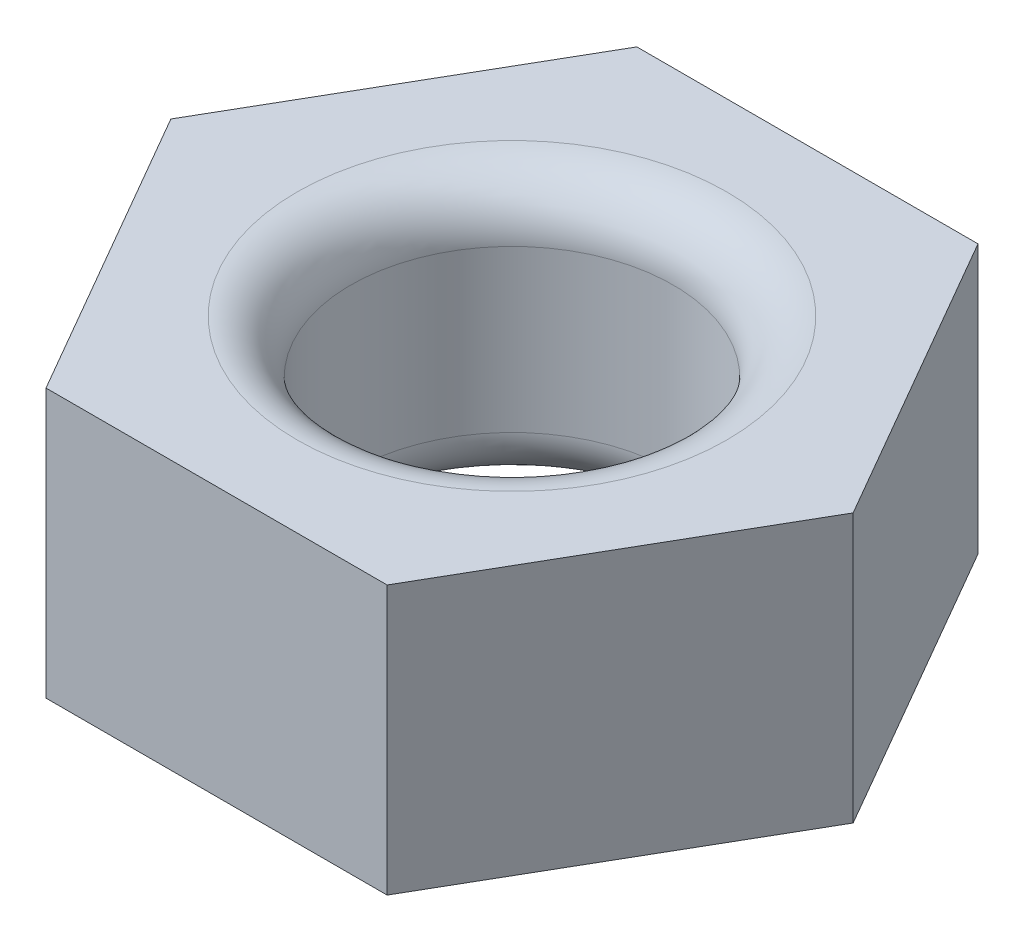
from build123d import *

# Parameters (mm, degrees)
SKETCH1_R           = 1.5
BOSS_EXTRUDE1_DEPTH = 2.5
FILLET1_R           = 0.5


with BuildPart() as part:
    # Sketch1 → Boss-Extrude1 (new body)
    with BuildSketch(Plane(origin=(0, 0, 0), x_dir=(1, 0, 0), z_dir=(0, 1, 0))):
        Polygon((-3.175426481, 0), (-1.58771324, -2.75), (1.58771324, -2.75), (3.175426481, 0), (1.58771324, 2.75), (-1.58771324, 2.75), align=None)
        with Locations(Location((0, 0, 0), (0, 0, 270))):
            Circle(SKETCH1_R, mode=Mode.SUBTRACT)
    extrude(amount=BOSS_EXTRUDE1_DEPTH)

    # Fillet1
    fillet1_edges = [part.edges().sort_by_distance(p)[0] for p in [
        (0, 0, -1.5),
        (0, 2.5, -1.5),
    ]]
    fillet(fillet1_edges, radius=FILLET1_R)


solid = part.part
